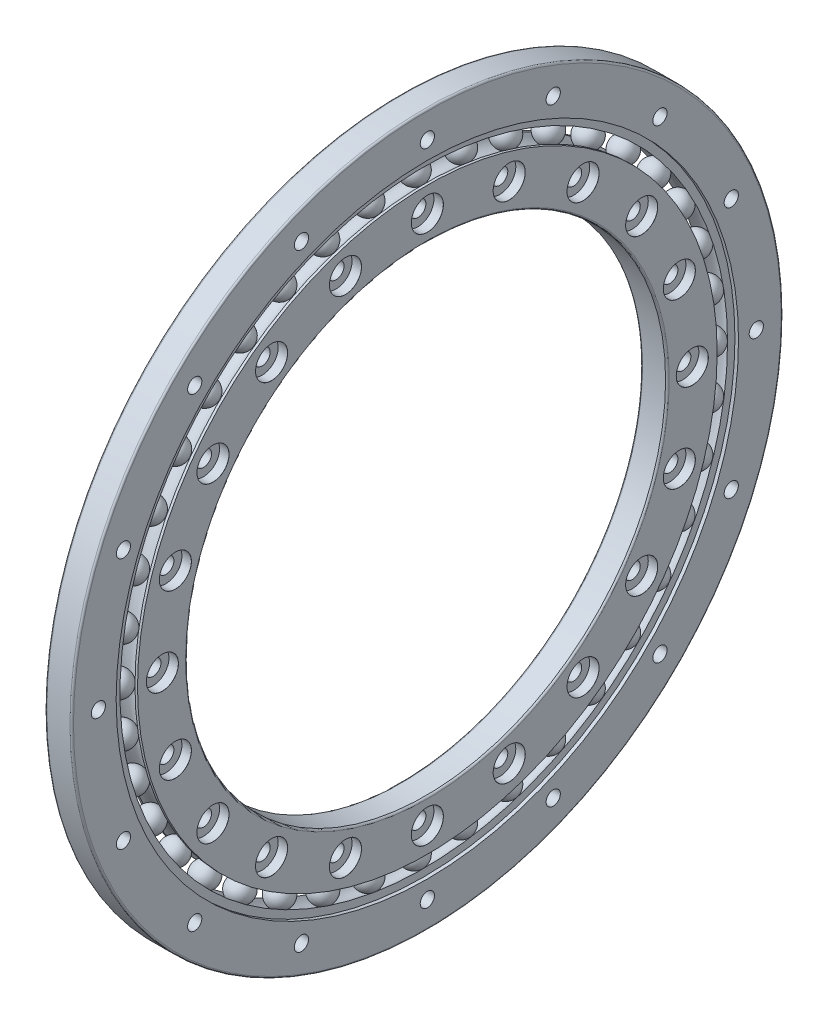
from build123d import *

# Parameters (mm, degrees)
CUT_EXTRUDE1_START = -2
SKETCH4_R          = 175
SKETCH4_R_2        = 170
CUT_EXTRUDE1_DEPTH = 2
FILLET1_R          = 1
FILLET2_R          = 1
CIRPATTERN1_COUNT  = 40
CIRPATTERN2_COUNT  = 20
SKETCH12_W         = 4
SKETCH12_H         = 15
CIRPATTERN3_COUNT  = 16


with BuildPart() as part:
    # Sketch1 → Revolve1 (revolve)
    with BuildSketch(Plane.XY):
        with BuildLine():
            Line((6.062177826, 170), (7.5, 170))
            Line((7.5, 170), (7.5, 200))
            Line((7.5, 200), (-7.5, 200))
            Line((-7.5, 200), (-7.5, 170))
            Line((-7.5, 170), (-6.062177826, 170))
            ThreePointArc((-6.062177826, 170), (0, 173.5), (6.062177826, 170))
        make_face()
        with BuildLine():
            ThreePointArc((6.062177826, 163), (0, 159.5), (-6.062177826, 163))
            Line((-6.062177826, 163), (-7.5, 163))
            Line((-7.5, 163), (-7.5, 135))
            Line((-7.5, 135), (7.5, 135))
            Line((7.5, 135), (7.5, 163))
            Line((7.5, 163), (6.062177826, 163))
        make_face()
    revolve(axis=Axis((0, 0, 0), (-1, 0, 0)))

    # Sketch4 → Cut-Extrude1 (cut)
    with BuildSketch(Plane.ZY.offset(7.5).offset(CUT_EXTRUDE1_START)):
        Circle(SKETCH4_R)
        Circle(SKETCH4_R_2, mode=Mode.SUBTRACT)
    cut_extrude1 = extrude(amount=CUT_EXTRUDE1_DEPTH, mode=Mode.SUBTRACT)

    # Mirror1: Cut-Extrude1 across plane
    add(cut_extrude1.mirror(Plane(origin=(0, 0, 0), x_dir=(0, 0, 1), z_dir=(1, 0, 0))), mode=Mode.SUBTRACT)

    # Fillet1
    fillet1_edges = [part.edges().sort_by_distance(p)[0] for p in [
        (7.5, -200, 0),
        (-7.5, -200, 0),
    ]]
    fillet(fillet1_edges, radius=FILLET1_R)

    # Fillet2
    fillet2_edges = [part.edges().sort_by_distance(p)[0] for p in [
        (7.5, -135, 0),
        (-7.5, -135, 0),
    ]]
    fillet(fillet2_edges, radius=FILLET2_R)

    # Sketch8 → CBORE for M8 Hex Head Bolt1 (revolve, cut)
    with BuildSketch(Plane(origin=(7.5, 149, 0), x_dir=(0, 0, -1), z_dir=(0, 1, 0))):
        Polygon((0, 0), (0, 15), (4.5, 15), (4.5, 5.3), (9.0055, 5.3), (9.0055, 0.025), (9.0305, 0), align=None)
    cbore_for_m8_hex_head_bolt1 = revolve(axis=Axis((13.85, 149, 0), (-1, 0, 0)), mode=Mode.SUBTRACT)

    # CirPattern2: CBORE for M8 Hex Head Bolt1 ×20 about axis
    cirpattern2_axis = Axis((-89.894182178, 0, 0), (1, 0, 0))
    for i in range(1, CIRPATTERN2_COUNT):
        add(cbore_for_m8_hex_head_bolt1.rotate(cirpattern2_axis, i * 360 / CIRPATTERN2_COUNT), mode=Mode.SUBTRACT)

    # Sketch12 → Ø8.0mm Dowel Hole1 (revolve, cut)
    with BuildSketch(Plane(origin=(7.5, 185, 0), x_dir=(0, 0, -1), z_dir=(0, 1, 0))):
        with Locations((2, 7.5)):
            Rectangle(SKETCH12_W, SKETCH12_H)
    f_8_0mm_dowel_hole1 = revolve(axis=Axis((13.85, 185, 0), (-1, 0, 0)), mode=Mode.SUBTRACT)

    # CirPattern3: Ø8.0mm Dowel Hole1 ×16 about axis
    cirpattern3_axis = Axis((-89.894182178, 0, 0), (1, 0, 0))
    for i in range(1, CIRPATTERN3_COUNT):
        add(f_8_0mm_dowel_hole1.rotate(cirpattern3_axis, i * 360 / CIRPATTERN3_COUNT), mode=Mode.SUBTRACT)


with BuildPart() as body_2:
    # Sketch6 → Revolve2 (revolve)
    with BuildSketch(Plane(origin=(0, 0, 0), x_dir=(1, 0, 0), z_dir=(0, 1, 0))):
        with BuildLine():
            Line((-6.9, 166.5), (6.9, 166.5))
            ThreePointArc((6.9, 166.5), (0, 173.4), (-6.9, 166.5))
        make_face()
    revolve(axis=Axis((-6.9, 0, -166.5), (1, 0, 0)))


with BuildPart() as cirpattern1_1:
    # CirPattern1: pattern copy
    add(body_2.part.rotate(Axis((-89.894182178, 0, 0), (1, 0, 0)), 1 * 360 / CIRPATTERN1_COUNT))


with BuildPart() as cirpattern1_2:
    # CirPattern1: pattern copy
    add(body_2.part.rotate(Axis((-89.894182178, 0, 0), (1, 0, 0)), 2 * 360 / CIRPATTERN1_COUNT))


with BuildPart() as cirpattern1_3:
    # CirPattern1: pattern copy
    add(body_2.part.rotate(Axis((-89.894182178, 0, 0), (1, 0, 0)), 3 * 360 / CIRPATTERN1_COUNT))


with BuildPart() as cirpattern1_4:
    # CirPattern1: pattern copy
    add(body_2.part.rotate(Axis((-89.894182178, 0, 0), (1, 0, 0)), 4 * 360 / CIRPATTERN1_COUNT))


with BuildPart() as cirpattern1_5:
    # CirPattern1: pattern copy
    add(body_2.part.rotate(Axis((-89.894182178, 0, 0), (1, 0, 0)), 5 * 360 / CIRPATTERN1_COUNT))


with BuildPart() as cirpattern1_6:
    # CirPattern1: pattern copy
    add(body_2.part.rotate(Axis((-89.894182178, 0, 0), (1, 0, 0)), 6 * 360 / CIRPATTERN1_COUNT))


with BuildPart() as cirpattern1_7:
    # CirPattern1: pattern copy
    add(body_2.part.rotate(Axis((-89.894182178, 0, 0), (1, 0, 0)), 7 * 360 / CIRPATTERN1_COUNT))


with BuildPart() as cirpattern1_8:
    # CirPattern1: pattern copy
    add(body_2.part.rotate(Axis((-89.894182178, 0, 0), (1, 0, 0)), 8 * 360 / CIRPATTERN1_COUNT))


with BuildPart() as cirpattern1_9:
    # CirPattern1: pattern copy
    add(body_2.part.rotate(Axis((-89.894182178, 0, 0), (1, 0, 0)), 9 * 360 / CIRPATTERN1_COUNT))


with BuildPart() as cirpattern1_10:
    # CirPattern1: pattern copy
    add(body_2.part.rotate(Axis((-89.894182178, 0, 0), (1, 0, 0)), 10 * 360 / CIRPATTERN1_COUNT))


with BuildPart() as cirpattern1_11:
    # CirPattern1: pattern copy
    add(body_2.part.rotate(Axis((-89.894182178, 0, 0), (1, 0, 0)), 11 * 360 / CIRPATTERN1_COUNT))


with BuildPart() as cirpattern1_12:
    # CirPattern1: pattern copy
    add(body_2.part.rotate(Axis((-89.894182178, 0, 0), (1, 0, 0)), 12 * 360 / CIRPATTERN1_COUNT))


with BuildPart() as cirpattern1_13:
    # CirPattern1: pattern copy
    add(body_2.part.rotate(Axis((-89.894182178, 0, 0), (1, 0, 0)), 13 * 360 / CIRPATTERN1_COUNT))


with BuildPart() as cirpattern1_14:
    # CirPattern1: pattern copy
    add(body_2.part.rotate(Axis((-89.894182178, 0, 0), (1, 0, 0)), 14 * 360 / CIRPATTERN1_COUNT))


with BuildPart() as cirpattern1_15:
    # CirPattern1: pattern copy
    add(body_2.part.rotate(Axis((-89.894182178, 0, 0), (1, 0, 0)), 15 * 360 / CIRPATTERN1_COUNT))


with BuildPart() as cirpattern1_16:
    # CirPattern1: pattern copy
    add(body_2.part.rotate(Axis((-89.894182178, 0, 0), (1, 0, 0)), 16 * 360 / CIRPATTERN1_COUNT))


with BuildPart() as cirpattern1_17:
    # CirPattern1: pattern copy
    add(body_2.part.rotate(Axis((-89.894182178, 0, 0), (1, 0, 0)), 17 * 360 / CIRPATTERN1_COUNT))


with BuildPart() as cirpattern1_18:
    # CirPattern1: pattern copy
    add(body_2.part.rotate(Axis((-89.894182178, 0, 0), (1, 0, 0)), 18 * 360 / CIRPATTERN1_COUNT))


with BuildPart() as cirpattern1_19:
    # CirPattern1: pattern copy
    add(body_2.part.rotate(Axis((-89.894182178, 0, 0), (1, 0, 0)), 19 * 360 / CIRPATTERN1_COUNT))


with BuildPart() as cirpattern1_20:
    # CirPattern1: pattern copy
    add(body_2.part.rotate(Axis((-89.894182178, 0, 0), (1, 0, 0)), 20 * 360 / CIRPATTERN1_COUNT))


with BuildPart() as cirpattern1_21:
    # CirPattern1: pattern copy
    add(body_2.part.rotate(Axis((-89.894182178, 0, 0), (1, 0, 0)), 21 * 360 / CIRPATTERN1_COUNT))


with BuildPart() as cirpattern1_22:
    # CirPattern1: pattern copy
    add(body_2.part.rotate(Axis((-89.894182178, 0, 0), (1, 0, 0)), 22 * 360 / CIRPATTERN1_COUNT))


with BuildPart() as cirpattern1_23:
    # CirPattern1: pattern copy
    add(body_2.part.rotate(Axis((-89.894182178, 0, 0), (1, 0, 0)), 23 * 360 / CIRPATTERN1_COUNT))


with BuildPart() as cirpattern1_24:
    # CirPattern1: pattern copy
    add(body_2.part.rotate(Axis((-89.894182178, 0, 0), (1, 0, 0)), 24 * 360 / CIRPATTERN1_COUNT))


with BuildPart() as cirpattern1_25:
    # CirPattern1: pattern copy
    add(body_2.part.rotate(Axis((-89.894182178, 0, 0), (1, 0, 0)), 25 * 360 / CIRPATTERN1_COUNT))


with BuildPart() as cirpattern1_26:
    # CirPattern1: pattern copy
    add(body_2.part.rotate(Axis((-89.894182178, 0, 0), (1, 0, 0)), 26 * 360 / CIRPATTERN1_COUNT))


with BuildPart() as cirpattern1_27:
    # CirPattern1: pattern copy
    add(body_2.part.rotate(Axis((-89.894182178, 0, 0), (1, 0, 0)), 27 * 360 / CIRPATTERN1_COUNT))


with BuildPart() as cirpattern1_28:
    # CirPattern1: pattern copy
    add(body_2.part.rotate(Axis((-89.894182178, 0, 0), (1, 0, 0)), 28 * 360 / CIRPATTERN1_COUNT))


with BuildPart() as cirpattern1_29:
    # CirPattern1: pattern copy
    add(body_2.part.rotate(Axis((-89.894182178, 0, 0), (1, 0, 0)), 29 * 360 / CIRPATTERN1_COUNT))


with BuildPart() as cirpattern1_30:
    # CirPattern1: pattern copy
    add(body_2.part.rotate(Axis((-89.894182178, 0, 0), (1, 0, 0)), 30 * 360 / CIRPATTERN1_COUNT))


with BuildPart() as cirpattern1_31:
    # CirPattern1: pattern copy
    add(body_2.part.rotate(Axis((-89.894182178, 0, 0), (1, 0, 0)), 31 * 360 / CIRPATTERN1_COUNT))


with BuildPart() as cirpattern1_32:
    # CirPattern1: pattern copy
    add(body_2.part.rotate(Axis((-89.894182178, 0, 0), (1, 0, 0)), 32 * 360 / CIRPATTERN1_COUNT))


with BuildPart() as cirpattern1_33:
    # CirPattern1: pattern copy
    add(body_2.part.rotate(Axis((-89.894182178, 0, 0), (1, 0, 0)), 33 * 360 / CIRPATTERN1_COUNT))


with BuildPart() as cirpattern1_34:
    # CirPattern1: pattern copy
    add(body_2.part.rotate(Axis((-89.894182178, 0, 0), (1, 0, 0)), 34 * 360 / CIRPATTERN1_COUNT))


with BuildPart() as cirpattern1_35:
    # CirPattern1: pattern copy
    add(body_2.part.rotate(Axis((-89.894182178, 0, 0), (1, 0, 0)), 35 * 360 / CIRPATTERN1_COUNT))


with BuildPart() as cirpattern1_36:
    # CirPattern1: pattern copy
    add(body_2.part.rotate(Axis((-89.894182178, 0, 0), (1, 0, 0)), 36 * 360 / CIRPATTERN1_COUNT))


with BuildPart() as cirpattern1_37:
    # CirPattern1: pattern copy
    add(body_2.part.rotate(Axis((-89.894182178, 0, 0), (1, 0, 0)), 37 * 360 / CIRPATTERN1_COUNT))


with BuildPart() as cirpattern1_38:
    # CirPattern1: pattern copy
    add(body_2.part.rotate(Axis((-89.894182178, 0, 0), (1, 0, 0)), 38 * 360 / CIRPATTERN1_COUNT))


with BuildPart() as cirpattern1_39:
    # CirPattern1: pattern copy
    add(body_2.part.rotate(Axis((-89.894182178, 0, 0), (1, 0, 0)), 39 * 360 / CIRPATTERN1_COUNT))


solid = Compound([part.part, body_2.part, cirpattern1_1.part, cirpattern1_2.part, cirpattern1_3.part, cirpattern1_4.part, cirpattern1_5.part, cirpattern1_6.part, cirpattern1_7.part, cirpattern1_8.part, cirpattern1_9.part, cirpattern1_10.part, cirpattern1_11.part, cirpattern1_12.part, cirpattern1_13.part, cirpattern1_14.part, cirpattern1_15.part, cirpattern1_16.part, cirpattern1_17.part, cirpattern1_18.part, cirpattern1_19.part, cirpattern1_20.part, cirpattern1_21.part, cirpattern1_22.part, cirpattern1_23.part, cirpattern1_24.part, cirpattern1_25.part, cirpattern1_26.part, cirpattern1_27.part, cirpattern1_28.part, cirpattern1_29.part, cirpattern1_30.part, cirpattern1_31.part, cirpattern1_32.part, cirpattern1_33.part, cirpattern1_34.part, cirpattern1_35.part, cirpattern1_36.part, cirpattern1_37.part, cirpattern1_38.part, cirpattern1_39.part])
